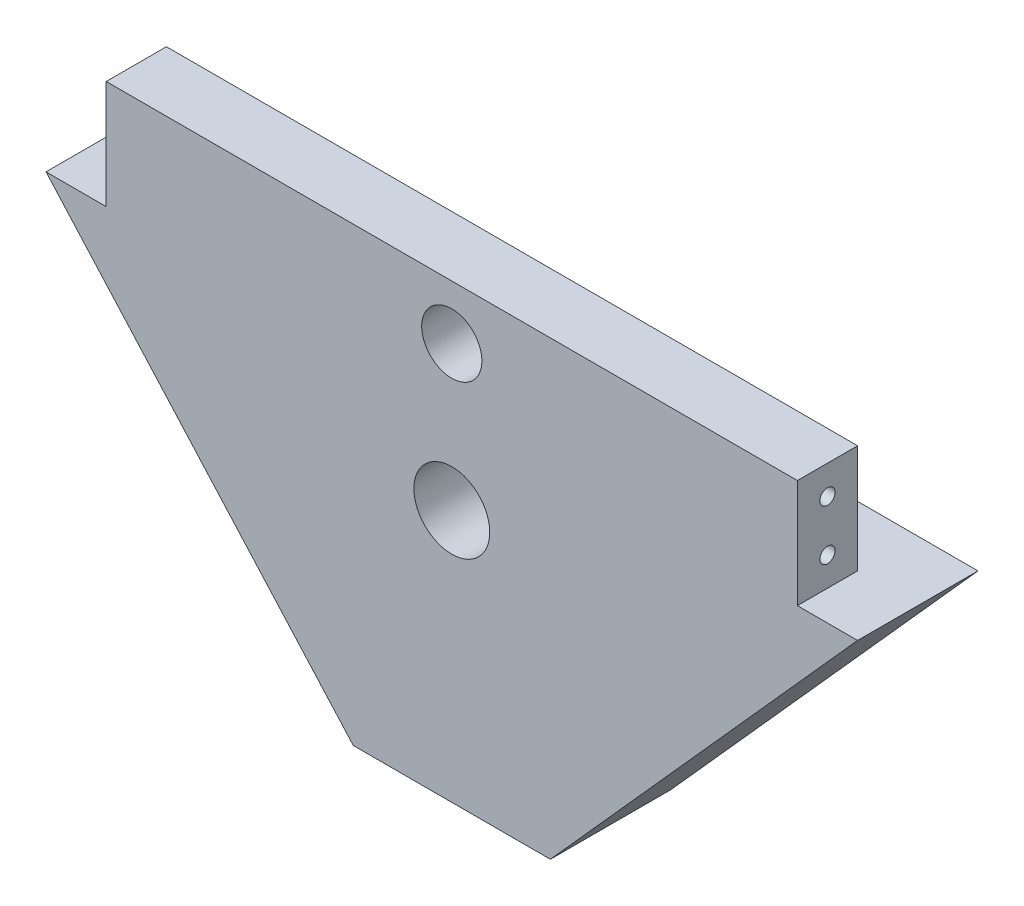
from build123d import *

# Parameters (mm, degrees)
BOSS_EXTRUDE1_DEPTH            = 12.7
SKETCH2_R                      = 3.175
CUT_EXTRUDE1_DEPTH             = 62.233889922
SKETCH3_W                      = 6.35
SKETCH3_H                      = 11.43
CUT_EXTRUDE2_DEPTH             = 97.151665612
SKETCH4_R                      = 4
CUT_EXTRUDE3_DEPTH             = 62.233889922
SKETCH5_R                      = 1
CUT_EXTRUDE4_DEPTH             = 62.233889922
SKETCH6_W                      = 6.35
SKETCH6_H                      = 11.43
CUT_EXTRUDE5_DEPTH             = 61.238042589
M2X0_4_TAPPED_HOLE1_AT_2_COUNT = 2
M2X0_4_TAPPED_HOLE1_AT_2_PITCH = 5.334


with BuildPart() as part:
    # Sketch1 → Boss-Extrude1 (new body)
    with BuildSketch(Plane.XY):
        Polygon((-42.800130549, -5.715), (-10.39539802, -41.91), (10.39539802, -41.91), (42.800130549, -5.715), (42.800130549, 5.715), (-42.800130549, 5.715), align=None)
    extrude(amount=-BOSS_EXTRUDE1_DEPTH)

    # Sketch2 → Cut-Extrude1 (cut, through all)
    with BuildSketch(Plane.XY):
        Circle(SKETCH2_R)
    extrude(amount=-CUT_EXTRUDE1_DEPTH, mode=Mode.SUBTRACT)

    # Sketch3 → Cut-Extrude2 (cut, through all)
    with BuildSketch(Plane(origin=(42.800130549, 0, 0), x_dir=(0, 0, -1), z_dir=(1, 0, 0))):
        with Locations((9.525, 0)):
            Rectangle(SKETCH3_W, SKETCH3_H)
    extrude(amount=-CUT_EXTRUDE2_DEPTH, mode=Mode.SUBTRACT)

    # Sketch4 → Cut-Extrude3 (cut, through all)
    with BuildSketch(Plane.XY):
        with Locations((0, -15.24)):
            Circle(SKETCH4_R)
    extrude(amount=-CUT_EXTRUDE3_DEPTH, mode=Mode.SUBTRACT)

    # Sketch5 → Cut-Extrude4 (cut, through all)
    with BuildSketch(Plane.XY):
        with Locations((39.625130549, 3.175)):
            Circle(SKETCH5_R)
        with Locations((39.625130549, -3.175)):
            Circle(SKETCH5_R)
    cut_extrude4 = extrude(amount=-CUT_EXTRUDE4_DEPTH, mode=Mode.SUBTRACT)

    # Mirror1: Cut-Extrude4 across plane
    add(cut_extrude4.mirror(Plane(origin=(0, 0, 0), x_dir=(0, 0, 1), z_dir=(1, 0, 0))), mode=Mode.SUBTRACT)

    # Sketch6 → Cut-Extrude5 (cut, through all)
    with BuildSketch(Plane(origin=(0, 0, -6.35), x_dir=(-1, 0, 0), z_dir=(0, 0, -1))):
        with Locations((-39.625130549, 0)):
            Rectangle(SKETCH6_W, SKETCH6_H)
        with Locations((39.625130549, 0)):
            Rectangle(SKETCH6_W, SKETCH6_H)
    extrude(amount=-CUT_EXTRUDE5_DEPTH, mode=Mode.SUBTRACT)

    # Sketch8 → M2x0.4 Tapped Hole1 (revolve, cut)
    with BuildSketch(Plane(origin=(-36.450130549, 2.667, -3.175), x_dir=(0, 0, 1), z_dir=(0, 1, 0))):
        Polygon((0, 0), (0, 5.814688495), (0.8, 5.334), (0.8, 0), align=None)
    m2x0_4_tapped_hole1 = revolve(axis=Axis((-42.800130549, 2.667, -3.175), (1, 0, 0)), mode=Mode.SUBTRACT)

    # M2x0.4 Tapped Hole1 at 2: M2x0.4 Tapped Hole1 ×2
    with Locations(*[(0, -i * M2X0_4_TAPPED_HOLE1_AT_2_PITCH, 0) for i in range(1, M2X0_4_TAPPED_HOLE1_AT_2_COUNT)]):
        add(m2x0_4_tapped_hole1, mode=Mode.SUBTRACT)

    # Mirror2: M2x0.4 Tapped Hole1 across plane
    add(m2x0_4_tapped_hole1.mirror(Plane(origin=(0, 0, 0), x_dir=(0, 0, 1), z_dir=(1, 0, 0))), mode=Mode.SUBTRACT)

    # Mirror2 copy 1 sketch → Mirror2 copy 1 (revolve, cut)
    with BuildSketch(Plane(origin=(36.450130549, -2.667, -3.175), x_dir=(0, 0, 1), z_dir=(0, 1, 0))):
        Polygon((0, 0), (0, -5.814688495), (0.8, -5.334), (0.8, 0), align=None)
    revolve(axis=Axis((42.800130549, -2.667, -3.175), (1, 0, 0)), mode=Mode.SUBTRACT)


solid = part.part
